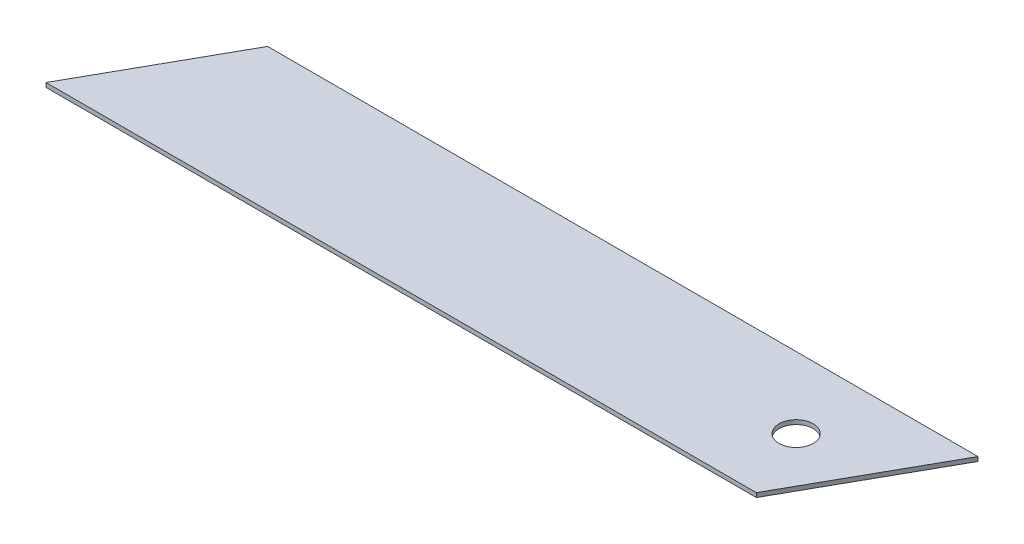
from build123d import *

# Parameters (mm, degrees)
SKETCH1_R           = 3.048
BOSS_EXTRUDE1_DEPTH = 0.762


with BuildPart() as part:
    # Sketch1 → Boss-Extrude1 (new body)
    with BuildSketch(Plane(origin=(0, 0, 0), x_dir=(1, 0, 0), z_dir=(0, 1, 0))):
        Polygon((14.224, 25.4), (0, 0), (127, 0), (141.224, 25.4), align=None)
        with Locations(Location((121.412, 12.7, 0), (0, 0, 90))):
            Circle(SKETCH1_R, mode=Mode.SUBTRACT)
    extrude(amount=BOSS_EXTRUDE1_DEPTH)


solid = part.part
